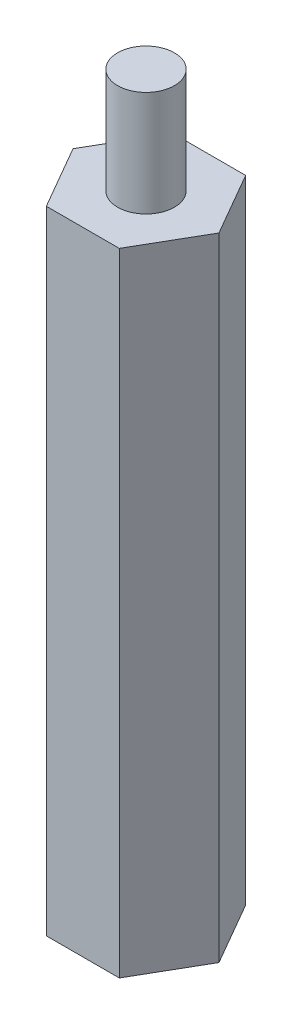
from build123d import *

# Parameters (mm, degrees)
EXTRUDE_1_DEPTH     = 30
SKETCH_2_R          = 1.35
EXTRUDE_2_DEPTH     = 5
SKETCH_3_R          = 1.35
CUT_EXTRUDE_1_DEPTH = 6


with BuildPart() as part:
    # 스케치1 → 보스-돌출1 (new body)
    with BuildSketch(Plane(origin=(0, 0, 0), x_dir=(1, 0, 0), z_dir=(0, 1, 0))):
        Polygon((3.464101615, 0), (1.732050808, 3), (-1.732050808, 3), (-3.464101615, 0), (-1.732050808, -3), (1.732050808, -3), align=None)
    extrude(amount=EXTRUDE_1_DEPTH)

    # 스케치2 → 보스-돌출2 (add)
    with BuildSketch(Plane(origin=(0, 30, 0), x_dir=(1, 0, 0), z_dir=(0, 1, 0))):
        with Locations(Location((0, 0, 0), (0, 0, 270))):
            Circle(SKETCH_2_R)
    extrude(amount=EXTRUDE_2_DEPTH)

    # 스케치3 → 컷-돌출1 (cut)
    with BuildSketch(Plane.XZ):
        with Locations(Location((0, 0, 0), (0, 0, 90))):
            Circle(SKETCH_3_R)
    extrude(amount=-CUT_EXTRUDE_1_DEPTH, mode=Mode.SUBTRACT)


solid = part.part
